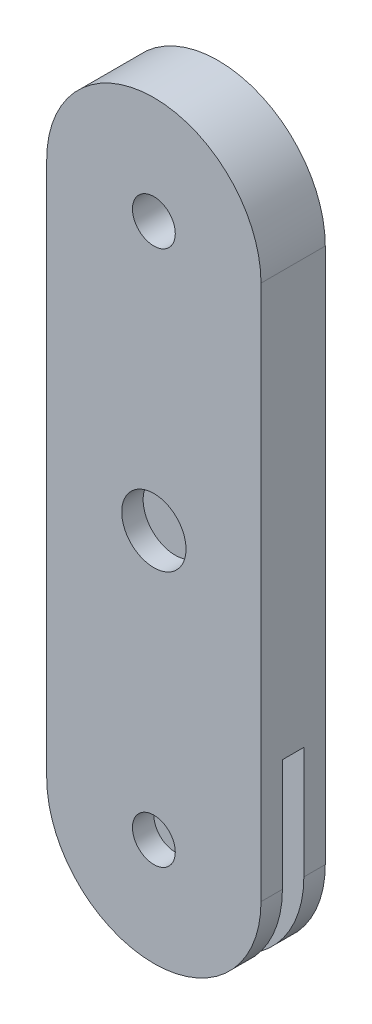
from build123d import *

# Parameters (mm, degrees)
BOSS_EXTRU_2_DEPTH           = 15
ENL_V_MAT_EXTRU_1_DEPTH      = 5
ESQUISSE3_R                  = 10
ENL_V_MAT_EXTRU_2_DEPTH      = 306.614135799
ESQUISSE5_R                  = 15
ENL_V_MAT_EXTRU_3_DEPTH      = 15
ENL_V_MAT_EXTRU_4_DEPTH      = 210
ENL_V_MAT_EXTRU_4_DEPTH_BACK = 305.795013083
ESQUISSE4_R                  = 10


with BuildPart() as part:
    # Esquisse1 → Boss.-Extru.2 (new, symmetric)
    with BuildSketch(Plane.XY):
        with BuildLine():
            Line((50, 0), (50, -250))
            ThreePointArc((50, -250), (0, -300), (-50, -250))
            Line((-50, -250), (-50, 0))
            ThreePointArc((-50, 0), (0, 50), (50, 0))
        make_face()
    extrude(amount=BOSS_EXTRU_2_DEPTH, both=True)

    # Esquisse2 → Enlèv. mat.-Extru.1 (cut, symmetric)
    with BuildSketch(Plane.XY):
        with BuildLine():
            Line((44.95, -184.342455173), (44.95, -56.882832679))
            ThreePointArc((44.95, -56.882832679), (42.021067812, -49.811764867), (34.95, -46.882832679))
            Line((34.95, -46.882832679), (-34.95, -46.882832679))
            ThreePointArc((-34.95, -46.882832679), (-42.021067812, -49.811764867), (-44.95, -56.882832679))
            Line((-44.95, -56.882832679), (-44.95, -184.342455173))
            ThreePointArc((-44.95, -184.342455173), (-47.390043652, -193.91574787), (-54.114793306, -201.153115359))
            Line((-54.114793306, -201.153115359), (-50, -198.500950871))
            Line((-50, -198.500950871), (-50, -250))
            ThreePointArc((-50, -250), (0, -300), (50, -250))
            Line((50, -250), (50, -198.500950871))
            Line((50, -198.500950871), (54.114793306, -201.153115359))
            ThreePointArc((54.114793306, -201.153115359), (47.390043652, -193.91574787), (44.95, -184.342455173))
        make_face()
    extrude(amount=ENL_V_MAT_EXTRU_1_DEPTH, both=True, mode=Mode.SUBTRACT)

    # Esquisse3 → Enlèv. mat.-Extru.2 (cut, through all)
    with BuildSketch(Plane.XY.offset(15)):
        Circle(ESQUISSE3_R)
    extrude(amount=-ENL_V_MAT_EXTRU_2_DEPTH, mode=Mode.SUBTRACT)

    # Esquisse5 → Enlèv. mat.-Extru.3 (cut)
    with BuildSketch(Plane.XY.offset(15)):
        with Locations((0, -125)):
            Circle(ESQUISSE5_R)
    extrude(amount=-ENL_V_MAT_EXTRU_3_DEPTH, mode=Mode.SUBTRACT)

    # Esquisse4 → Enlèv. mat.-Extru.4 (cut, two sides: drawn at the far end of the back side and taken through both)
    with BuildSketch(Plane.XY.offset(-5).offset(-ENL_V_MAT_EXTRU_4_DEPTH_BACK)):
        with Locations((0, -250)):
            Circle(ESQUISSE4_R)
    extrude(amount=ENL_V_MAT_EXTRU_4_DEPTH + ENL_V_MAT_EXTRU_4_DEPTH_BACK, mode=Mode.SUBTRACT)


solid = part.part
